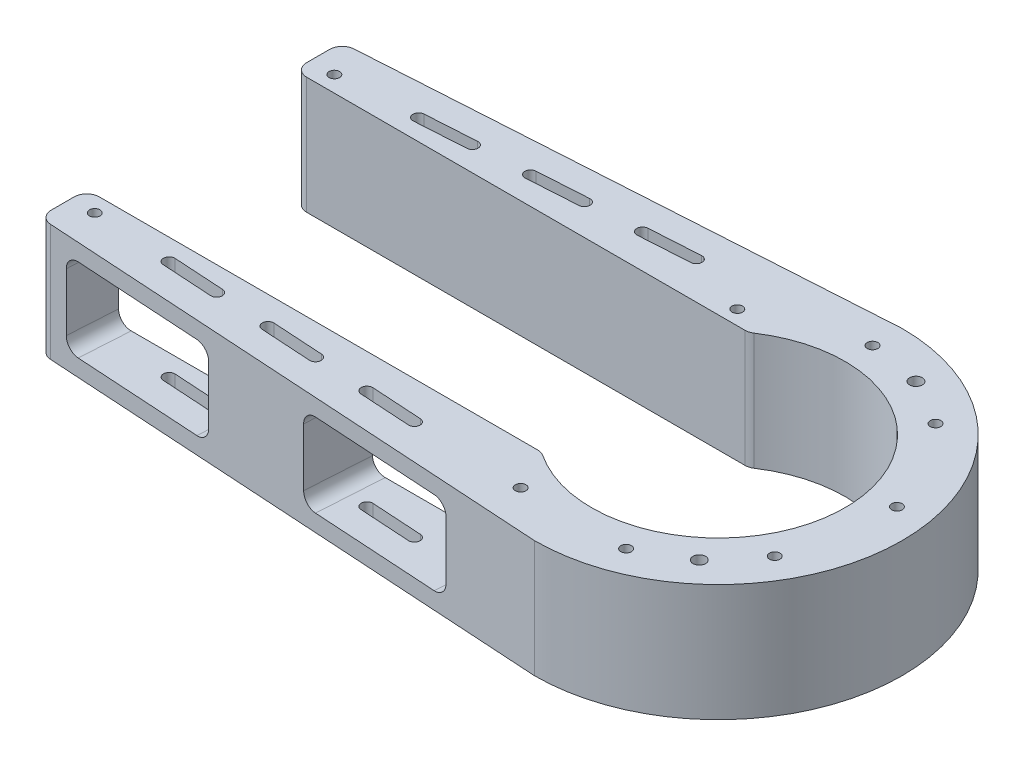
from build123d import *

# Parameters (mm, degrees)
EXTRUDE_1_DEPTH     = 27.7
SKETCH_3_R          = 1.25
SKETCH_3_R_2        = 30
SKETCH_3_R_3        = 1.5
CUT_EXTRUDE_1_DEPTH = 30
CUT_EXTRUDE_2_DEPTH = 3
SKETCH_5_R          = 1.25
CUT_EXTRUDE_3_DEPTH = 30
SKETCH_6_W          = 156.727051789
SKETCH_6_H          = 77.251269398
CUT_EXTRUDE_4_DEPTH = 36
SKETCH_7_W          = 110.29163623
SKETCH_7_H          = 49.067375992
CUT_EXTRUDE_5_DEPTH = 36
FILLET_1_R          = 3
CUT_EXTRUDE_6_DEPTH = 40
CUT_EXTRUDE_7_DEPTH = 40
FILLET_2_R          = 3


with BuildPart() as part:
    # 草图2 → 凸台-拉伸1 (new body)
    with BuildSketch(Plane(origin=(0, 5, 0), x_dir=(1, 0, 0), z_dir=(0, 1, 0))):
        with BuildLine():
            Line((-250, 28), (0, 43.5))
            ThreePointArc((0, 43.5), (43.5, 0), (0, -43.5))
            Line((0, -43.5), (-250, -28))
            ThreePointArc((-250, -28), (-278, 0), (-250, 28))
        make_face()
    extrude(amount=EXTRUDE_1_DEPTH)

    # 草图3 → 切除-拉伸1 (cut)
    with BuildSketch(Plane(origin=(0, 32.7, 0), x_dir=(1, 0, 0), z_dir=(0, 1, 0))):
        with Locations(Location((-250, 4, 0), (0, 0, 270))):
            Circle(SKETCH_3_R)
        with Locations(Location((-246, 0, 0), (0, 0, 270))):
            Circle(SKETCH_3_R)
        with Locations(Location((-250, -4, 0), (0, 0, 270))):
            Circle(SKETCH_3_R)
        with Locations(Location((-254, 0, 0), (0, 0, 270))):
            Circle(SKETCH_3_R)
        with Locations(Location((0, 0, 0), (0, 0, 270))):
            Circle(SKETCH_3_R_2)
        with Locations(Location((0, 36.5, 0), (0, 0, 270))):
            Circle(SKETCH_3_R)
        with Locations(Location((12.483735231, 34.298780659, 0), (0, 0, 270))):
            Circle(SKETCH_3_R_3)
        with Locations(Location((23.461747754, 27.960622174, 0), (0, 0, 270))):
            Circle(SKETCH_3_R)
        with Locations(Location((-23.461747754, 27.960622174, 0), (0, 0, 270))):
            Circle(SKETCH_3_R)
        with Locations(Location((-35.945482985, 6.338158485, 0), (0, 0, 270))):
            Circle(SKETCH_3_R)
        with Locations(Location((-35.945482985, -6.338158485, 0), (0, 0, 270))):
            Circle(SKETCH_3_R_3)
        with Locations(Location((-31.609927238, -18.25, 0), (0, 0, 270))):
            Circle(SKETCH_3_R)
        with Locations(Location((-12.483735231, -34.298780659, 0), (0, 0, 270))):
            Circle(SKETCH_3_R)
        with Locations(Location((12.483735231, -34.298780659, 0), (0, 0, 270))):
            Circle(SKETCH_3_R)
        with Locations(Location((23.461747754, -27.960622174, 0), (0, 0, 270))):
            Circle(SKETCH_3_R_3)
        with Locations(Location((31.609927238, -18.25, 0), (0, 0, 270))):
            Circle(SKETCH_3_R)
        with Locations(Location((35.945482985, 6.338158485, 0), (0, 0, 270))):
            Circle(SKETCH_3_R)
        with BuildLine():
            ThreePointArc((-265.553651429, 15.553651429), (-265.553651429, 11.316406256), (-261.316406256, 11.316406256))
            ThreePointArc((-261.316406256, 11.316406256), (-250, 16.003815204), (-238.683593744, 11.316406256))
            ThreePointArc((-238.683593744, 11.316406256), (-234.446348571, 11.316406256), (-234.446348571, 15.553651429))
            ThreePointArc((-234.446348571, 15.553651429), (-250, 21.996184796), (-265.553651429, 15.553651429))
        make_face()
        with BuildLine():
            ThreePointArc((-261.316406256, -11.316406256), (-250, -16.003815204), (-238.683593744, -11.316406256))
            ThreePointArc((-238.683593744, -11.316406256), (-234.446348571, -11.316406256), (-234.446348571, -15.553651429))
            ThreePointArc((-234.446348571, -15.553651429), (-250, -21.996184796), (-265.553651429, -15.553651429))
            ThreePointArc((-265.553651429, -15.553651429), (-265.553651429, -11.316406256), (-261.316406256, -11.316406256))
        make_face()
    extrude(amount=-CUT_EXTRUDE_1_DEPTH, mode=Mode.SUBTRACT)

    # 草图4 → 切除-拉伸2 (cut)
    with BuildSketch(Plane(origin=(0, 32.7, 0), x_dir=(1, 0, 0), z_dir=(0, 1, 0))):
        with BuildLine():
            Line((-216.23889617, 1.5), (-205.267472927, 20.503062488))
            ThreePointArc((-205.267472927, 20.503062488), (-199.762485666, 21.978119379), (-198.287428775, 16.473132117))
            Line((-198.287428775, 16.473132117), (-206.932170633, 1.5))
            ThreePointArc((-206.932170633, 1.5), (-207.334094422, 0), (-206.932170633, -1.5))
            Line((-206.932170633, -1.5), (-198.287428775, -16.473132117))
            ThreePointArc((-198.287428775, -16.473132117), (-199.762485666, -21.978119379), (-205.267472927, -20.503062488))
            Line((-205.267472927, -20.503062488), (-216.23889617, -1.5))
            ThreePointArc((-216.23889617, -1.5), (-216.640819958, 0), (-216.23889617, 1.5))
        make_face()
        with BuildLine():
            Line((-54.444025551, 1.5), (-65.7023558, 21))
            ThreePointArc((-65.7023558, 21), (-66.800432012, 22.098076211), (-68.300432012, 22.5))
            Line((-68.300432012, 22.5), (-90.81709251, 22.5))
            ThreePointArc((-90.81709251, 22.5), (-92.31709251, 22.098076211), (-93.415168722, 21))
            Line((-93.415168722, 21), (-104.673498971, 1.5))
            ThreePointArc((-104.673498971, 1.5), (-105.075422759, 0), (-104.673498971, -1.5))
            Line((-104.673498971, -1.5), (-93.415168722, -21))
            ThreePointArc((-93.415168722, -21), (-92.31709251, -22.098076211), (-90.81709251, -22.5))
            Line((-90.81709251, -22.5), (-68.300432012, -22.5))
            ThreePointArc((-68.300432012, -22.5), (-66.800432012, -22.098076211), (-65.7023558, -21))
            Line((-65.7023558, -21), (-54.444025551, -1.5))
            ThreePointArc((-54.444025551, -1.5), (-54.042101763, 0), (-54.444025551, 1.5))
        make_face()
        with BuildLine():
            Line((-188.932170633, -1.5), (-180.287428775, -16.473132117))
            ThreePointArc((-180.287428775, -16.473132117), (-181.762485666, -21.978119379), (-187.267472927, -20.503062488))
            Line((-187.267472927, -20.503062488), (-198.23889617, -1.5))
            ThreePointArc((-198.23889617, -1.5), (-198.640819958, 0), (-198.23889617, 1.5))
            Line((-198.23889617, 1.5), (-187.267472927, 20.503062488))
            ThreePointArc((-187.267472927, 20.503062488), (-181.762485666, 21.978119379), (-180.287428775, 16.473132117))
            Line((-180.287428775, 16.473132117), (-188.932170633, 1.5))
            ThreePointArc((-188.932170633, 1.5), (-189.334094422, 0), (-188.932170633, -1.5))
        make_face()
        with BuildLine():
            Line((-170.932170633, -1.5), (-162.287428775, -16.473132117))
            ThreePointArc((-162.287428775, -16.473132117), (-163.762485666, -21.978119379), (-169.267472927, -20.503062488))
            Line((-169.267472927, -20.503062488), (-180.23889617, -1.5))
            ThreePointArc((-180.23889617, -1.5), (-180.640819958, 0), (-180.23889617, 1.5))
            Line((-180.23889617, 1.5), (-169.267472927, 20.503062488))
            ThreePointArc((-169.267472927, 20.503062488), (-163.762485666, 21.978119379), (-162.287428775, 16.473132117))
            Line((-162.287428775, 16.473132117), (-170.932170633, 1.5))
            ThreePointArc((-170.932170633, 1.5), (-171.334094422, 0), (-170.932170633, -1.5))
        make_face()
        with BuildLine():
            Line((-152.932170633, -1.5), (-144.287428775, -16.473132117))
            ThreePointArc((-144.287428775, -16.473132117), (-145.762485666, -21.978119379), (-151.267472927, -20.503062488))
            Line((-151.267472927, -20.503062488), (-162.23889617, -1.5))
            ThreePointArc((-162.23889617, -1.5), (-162.640819958, 0), (-162.23889617, 1.5))
            Line((-162.23889617, 1.5), (-151.267472927, 20.503062488))
            ThreePointArc((-151.267472927, 20.503062488), (-145.762485666, 21.978119379), (-144.287428775, 16.473132117))
            Line((-144.287428775, 16.473132117), (-152.932170633, 1.5))
            ThreePointArc((-152.932170633, 1.5), (-153.334094422, 0), (-152.932170633, -1.5))
        make_face()
        with BuildLine():
            Line((-134.932170633, -1.5), (-126.287428775, -16.473132117))
            ThreePointArc((-126.287428775, -16.473132117), (-127.762485666, -21.978119379), (-133.267472927, -20.503062488))
            Line((-133.267472927, -20.503062488), (-144.23889617, -1.5))
            ThreePointArc((-144.23889617, -1.5), (-144.640819958, 0), (-144.23889617, 1.5))
            Line((-144.23889617, 1.5), (-133.267472927, 20.503062488))
            ThreePointArc((-133.267472927, 20.503062488), (-127.762485666, 21.978119379), (-126.287428775, 16.473132117))
            Line((-126.287428775, 16.473132117), (-134.932170633, 1.5))
            ThreePointArc((-134.932170633, 1.5), (-135.334094422, 0), (-134.932170633, -1.5))
        make_face()
        with BuildLine():
            Line((-116.932170633, -1.5), (-108.287428775, -16.473132117))
            ThreePointArc((-108.287428775, -16.473132117), (-109.762485666, -21.978119379), (-115.267472927, -20.503062488))
            Line((-115.267472927, -20.503062488), (-126.23889617, -1.5))
            ThreePointArc((-126.23889617, -1.5), (-126.640819958, 0), (-126.23889617, 1.5))
            Line((-126.23889617, 1.5), (-115.267472927, 20.503062488))
            ThreePointArc((-115.267472927, 20.503062488), (-109.762485666, 21.978119379), (-108.287428775, 16.473132117))
            Line((-108.287428775, 16.473132117), (-116.932170633, 1.5))
            ThreePointArc((-116.932170633, 1.5), (-117.334094422, 0), (-116.932170633, -1.5))
        make_face()
    extrude(amount=-CUT_EXTRUDE_2_DEPTH, mode=Mode.SUBTRACT)

    # 草图5 → 切除-拉伸3 (cut)
    with BuildSketch(Plane(origin=(0, 32.7, 0), x_dir=(1, 0, 0), z_dir=(0, 1, 0))):
        with Locations(Location((-44.941689831, 32.96361523, 0), (0, 0, 270))):
            Circle(SKETCH_5_R)
        with Locations(Location((-69.702891128, 31.42842075, 0), (0, 0, 270))):
            Circle(SKETCH_5_R)
        with Locations(Location((-119.225293723, 28.358031789, 0), (0, 0, 270))):
            Circle(SKETCH_5_R)
        with Locations(Location((-94.464092426, 29.89322627, 0), (0, 0, 270))):
            Circle(SKETCH_5_R)
        with Locations(Location((-44.941689831, -32.96361523, 0), (0, 0, 270))):
            Circle(SKETCH_5_R)
        with Locations(Location((-69.702891128, -31.42842075, 0), (0, 0, 270))):
            Circle(SKETCH_5_R)
        with Locations(Location((-94.464092426, -29.89322627, 0), (0, 0, 270))):
            Circle(SKETCH_5_R)
        with Locations(Location((-119.225293723, -28.358031789, 0), (0, 0, 270))):
            Circle(SKETCH_5_R)
    extrude(amount=-CUT_EXTRUDE_3_DEPTH, mode=Mode.SUBTRACT)

    # 草图6 → 切除-拉伸4 (cut)
    with BuildSketch(Plane(origin=(0, 32.7, 0), x_dir=(1, 0, 0), z_dir=(0, 1, 0))):
        with Locations((-203.311864761, 0.008219016)):
            Rectangle(SKETCH_6_W, SKETCH_6_H)
    extrude(amount=-CUT_EXTRUDE_4_DEPTH, mode=Mode.SUBTRACT)

    # 草图7 → 切除-拉伸5 (cut)
    with BuildSketch(Plane(origin=(0, 32.7, 0), x_dir=(1, 0, 0), z_dir=(0, 1, 0))):
        with Locations((-72.411337318, 0)):
            Rectangle(SKETCH_7_W, SKETCH_7_H)
    extrude(amount=-CUT_EXTRUDE_5_DEPTH, mode=Mode.SUBTRACT)

    # 圆角1
    fillet_1_edges = [part.edges().sort_by_distance(p)[0] for p in [
        (-124.948338866, 18.85, -35.75320299),
    ]]
    fillet(fillet_1_edges, radius=FILLET_1_R)

    # 草图8 → 切除-拉伸6 (cut)
    with BuildSketch(Plane(origin=(0, 32.7, 0), x_dir=(1, 0, 0), z_dir=(0, 1, 0))):
        with BuildLine():
            Line((-100.536133157, 30.869351956), (-88.559130876, 31.611926097))
            ThreePointArc((-88.559130876, 31.611926097), (-87.128178529, 30.348052931), (-88.392051694, 28.917100584))
            Line((-88.392051694, 28.917100584), (-100.369053976, 28.174526442))
            ThreePointArc((-100.369053976, 28.174526442), (-101.800006323, 29.438399608), (-100.536133157, 30.869351956))
        make_face()
        with BuildLine():
            Line((-75.41696589, 29.721555904), (-63.439963609, 30.464130045))
            ThreePointArc((-63.439963609, 30.464130045), (-62.176090443, 31.895082393), (-63.60704279, 33.158955558))
            Line((-63.60704279, 33.158955558), (-75.584045072, 32.416381417))
            ThreePointArc((-75.584045072, 32.416381417), (-76.847918237, 30.985429069), (-75.41696589, 29.721555904))
        make_face()
        with BuildLine():
            Line((-50.631956986, 33.963410878), (-38.654954704, 34.70598502))
            ThreePointArc((-38.654954704, 34.70598502), (-37.224002357, 33.442111854), (-38.487875523, 32.011159506))
            Line((-38.487875523, 32.011159506), (-50.464877804, 31.268585365))
            ThreePointArc((-50.464877804, 31.268585365), (-51.895830151, 32.532458531), (-50.631956986, 33.963410878))
        make_face()
        with BuildLine():
            Line((-50.631956986, -33.963410878), (-38.654954704, -34.70598502))
            ThreePointArc((-38.654954704, -34.70598502), (-37.224002357, -33.442111854), (-38.487875523, -32.011159506))
            Line((-38.487875523, -32.011159506), (-50.464877804, -31.268585365))
            ThreePointArc((-50.464877804, -31.268585365), (-51.895830151, -32.532458531), (-50.631956986, -33.963410878))
        make_face()
        with BuildLine():
            Line((-75.584045072, -32.416381417), (-63.60704279, -33.158955558))
            ThreePointArc((-63.60704279, -33.158955558), (-62.176090443, -31.895082393), (-63.439963609, -30.464130045))
            Line((-63.439963609, -30.464130045), (-75.41696589, -29.721555904))
            ThreePointArc((-75.41696589, -29.721555904), (-76.847918237, -30.985429069), (-75.584045072, -32.416381417))
        make_face()
        with BuildLine():
            Line((-100.536133157, -30.869351956), (-88.559130876, -31.611926097))
            ThreePointArc((-88.559130876, -31.611926097), (-87.128178529, -30.348052931), (-88.392051694, -28.917100584))
            Line((-88.392051694, -28.917100584), (-100.369053976, -28.174526442))
            ThreePointArc((-100.369053976, -28.174526442), (-101.800006323, -29.438399608), (-100.536133157, -30.869351956))
        make_face()
    extrude(amount=-CUT_EXTRUDE_6_DEPTH, mode=Mode.SUBTRACT)

    # 草图9 → 切除-拉伸7 (cut)
    with BuildSketch(Plane(origin=(-2.686672431, 0, 43.333426309), x_dir=(0.9980835234354231, 0, 0.06188117845299609), z_dir=(-0.06188117845299609, 6.9829626776862675e-15, 0.9980835234354231))):
        with BuildLine():
            Line((-55.676667498, 25.7), (-55.676667498, 12))
            ThreePointArc((-55.676667498, 12), (-54.797987842, 9.878679656), (-52.676667498, 9))
            Line((-52.676667498, 9), (-22.676667498, 9))
            ThreePointArc((-22.676667498, 9), (-20.555347155, 9.878679656), (-19.676667498, 12))
            Line((-19.676667498, 12), (-19.676667498, 25.7))
            ThreePointArc((-19.676667498, 25.7), (-20.555347155, 27.821320344), (-22.676667498, 28.7))
            Line((-22.676667498, 28.7), (-52.676667498, 28.7))
            ThreePointArc((-52.676667498, 28.7), (-54.797987842, 27.821320344), (-55.676667498, 25.7))
        make_face()
        with BuildLine():
            Line((-112.676667498, 28.7), (-82.676667498, 28.7))
            ThreePointArc((-82.676667498, 28.7), (-80.555347155, 27.821320344), (-79.676667498, 25.7))
            Line((-79.676667498, 25.7), (-79.676667498, 12))
            ThreePointArc((-79.676667498, 12), (-80.555347155, 9.878679656), (-82.676667498, 9))
            Line((-82.676667498, 9), (-112.676667498, 9))
            ThreePointArc((-112.676667498, 9), (-114.797987842, 9.878679656), (-115.676667498, 12))
            Line((-115.676667498, 12), (-115.676667498, 25.7))
            ThreePointArc((-115.676667498, 25.7), (-114.797987842, 27.821320344), (-112.676667498, 28.7))
        make_face()
    extrude(amount=-CUT_EXTRUDE_7_DEPTH, mode=Mode.SUBTRACT)

    # 圆角2
    fillet_2_edges = [part.edges().sort_by_distance(p)[0] for p in [
        (-124.948338866, 18.85, 35.75320299),
        (-124.948338866, 18.85, -24.533687996),
        (-124.948338866, 18.85, 24.533687996),
        (-17.265519203, 18.85, 24.533687996),
        (-17.265519203, 18.85, -24.533687996),
    ]]
    fillet(fillet_2_edges, radius=FILLET_2_R)


solid = part.part
